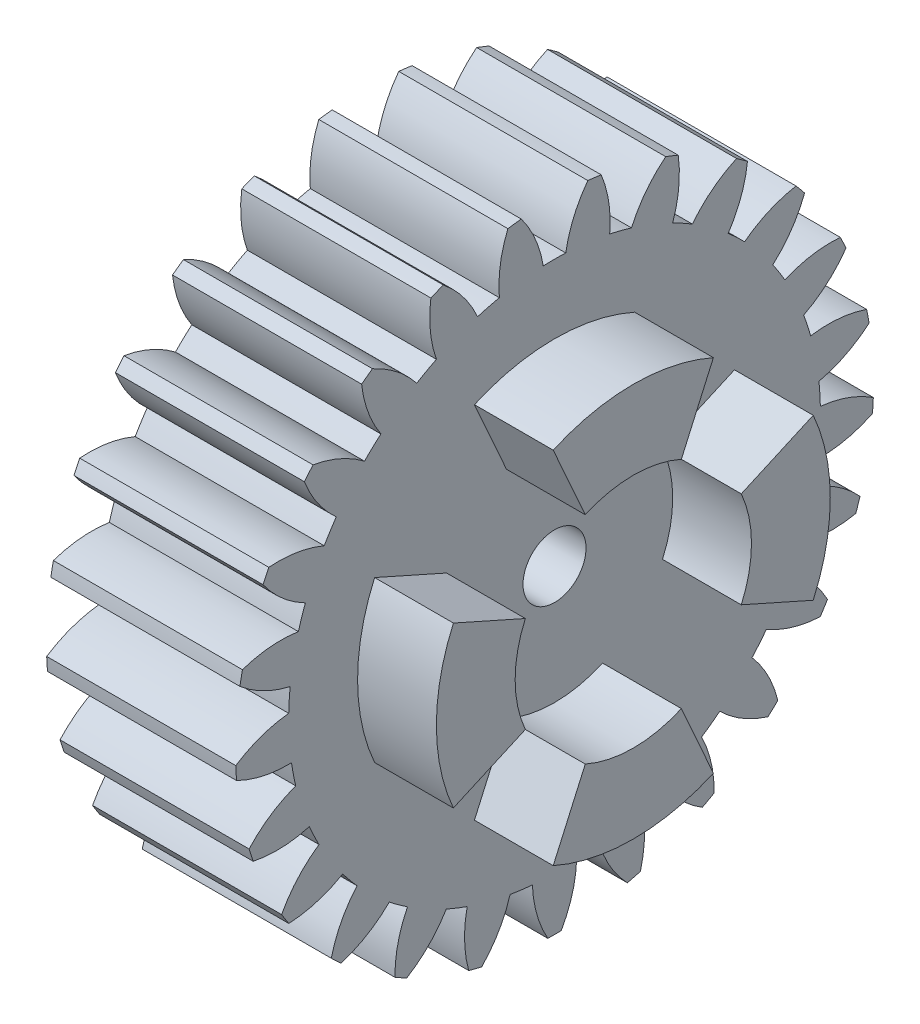
from build123d import *

# Parameters (mm, degrees)
BASPROSKE_W     = 12
BASPROSKE_H     = 20.25
TOOTHCUT_DEPTH  = 32.050362317
TEETHCUTS_COUNT = 25
TEETHCUTS_ANGLE = 345.6
BORSKE_R        = 2
BORE_DEPTH      = 50.0000508
EXTRUDE_1_DEPTH = 5


with BuildPart() as part:
    # BasProSke → Base-Revolve (revolve)
    with BuildSketch(Plane(origin=(0, 0, 0), x_dir=(1, 0, 0), z_dir=(0, 1, 0)), mode=Mode.PRIVATE) as base_revolve_sk:
        with Locations((6, 10.125)):
            Rectangle(BASPROSKE_W, BASPROSKE_H)
    revolve(base_revolve_sk.sketch.rotate(Axis((-10, 0, 0), (1, 0, 0)), 180), axis=Axis((-10, 0, 0), (1, 0, 0)))

    # TooCutSke → ToothCut (cut, through all)
    with BuildSketch(Plane(origin=(0, 0, 0), x_dir=(0, 0, -1), z_dir=(1, 0, 0))):
        with BuildLine():
            ThreePointArc((0.713909619, 16.858891098), (0, 16.874), (-0.713909619, 16.858891098))
            ThreePointArc((-0.713909619, 16.858891098), (-1.221902209, 18.597177626), (-2.131751691, 20.163022588))
            ThreePointArc((-2.131751691, 20.163022588), (0, 20.2754), (2.131751691, 20.163022588))
            ThreePointArc((2.131751691, 20.163022588), (1.221902209, 18.597177626), (0.713909619, 16.858891098))
        make_face()
    toothcut = extrude(amount=TOOTHCUT_DEPTH, mode=Mode.SUBTRACT)

    # TeethCuts: ToothCut ×25 about axis
    teethcuts_axis = Axis((-10, 0, 0), (1, 0, 0))
    for i in range(1, TEETHCUTS_COUNT):
        add(toothcut.rotate(teethcuts_axis, i * TEETHCUTS_ANGLE / (TEETHCUTS_COUNT - 1)), mode=Mode.SUBTRACT)

    # BorSke → Bore (cut, symmetric)
    with BuildSketch(Plane(origin=(0, 0, 0), x_dir=(0, 0, -1), z_dir=(1, 0, 0))):
        with Locations(Location((0, 0, 0), (0, 0, 180))):
            Circle(BORSKE_R)
    extrude(amount=BORE_DEPTH, both=True, mode=Mode.SUBTRACT)

    # 草图2 → 凸台-拉伸1 (add)
    with BuildSketch(Plane(origin=(12, 0, 0), x_dir=(0, 0, -1), z_dir=(1, 0, 0))):
        with BuildLine():
            Line((-3.049889257, 6.851873869), (-5.083148762, 11.419789782))
            ThreePointArc((-5.083148762, 11.419789782), (0, 12.5), (5.083148762, 11.419789782))
            Line((5.083148762, 11.419789782), (3.049889257, 6.851873869))
            ThreePointArc((3.049889257, 6.851873869), (0, 7.5), (-3.049889257, 6.851873869))
        make_face()
        with BuildLine():
            Line((6.851873869, 3.049889257), (11.419789782, 5.083148762))
            ThreePointArc((11.419789782, 5.083148762), (12.5, 0), (11.419789782, -5.083148762))
            Line((11.419789782, -5.083148762), (6.851873869, -3.049889257))
            ThreePointArc((6.851873869, -3.049889257), (7.5, 0), (6.851873869, 3.049889257))
        make_face()
        with BuildLine():
            Line((3.049889257, -6.851873869), (5.083148762, -11.419789782))
            ThreePointArc((5.083148762, -11.419789782), (0, -12.5), (-5.083148762, -11.419789782))
            Line((-5.083148762, -11.419789782), (-3.049889257, -6.851873869))
            ThreePointArc((-3.049889257, -6.851873869), (0, -7.5), (3.049889257, -6.851873869))
        make_face()
        with BuildLine():
            Line((-6.851873869, -3.049889257), (-11.419789782, -5.083148762))
            ThreePointArc((-11.419789782, -5.083148762), (-12.5, 0), (-11.419789782, 5.083148762))
            Line((-11.419789782, 5.083148762), (-6.851873869, 3.049889257))
            ThreePointArc((-6.851873869, 3.049889257), (-7.5, 0), (-6.851873869, -3.049889257))
        make_face()
    extrude(amount=EXTRUDE_1_DEPTH)


solid = part.part
